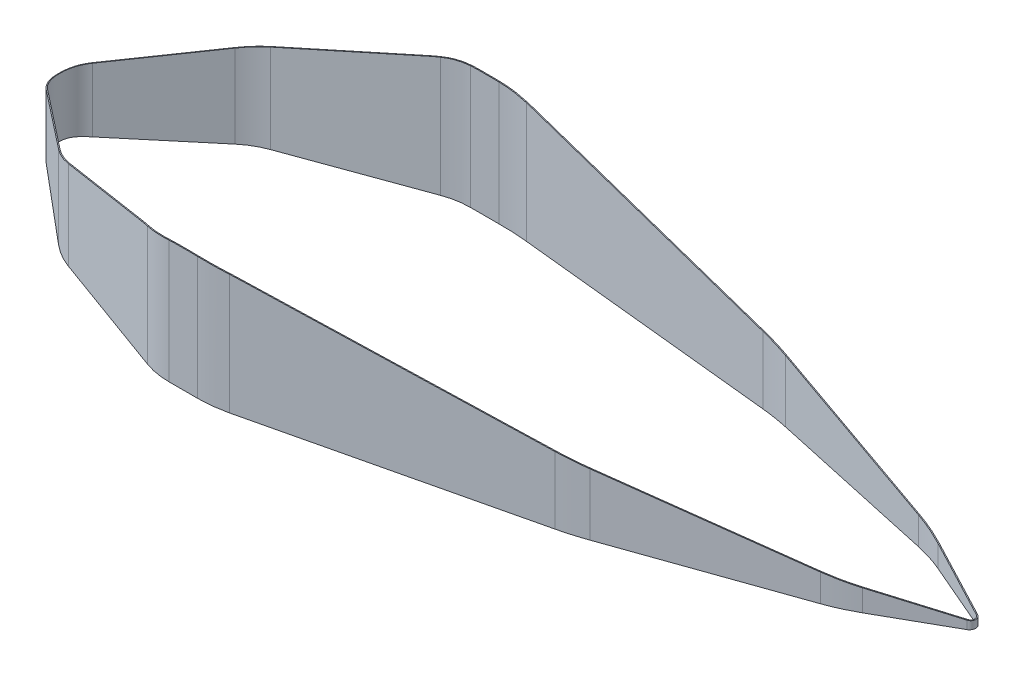
from build123d import *

# Parameters (mm, degrees)
TOPVIEW_EXTRUDE_DEPTH      = 800
SHELL1_T                   = -5
SIDEPROFILE_CUT_DEPTH      = 5065.329373382
SIDEPROFILE_CUT_DEPTH_BACK = 5065.329373382
SKETCH2_OUTSIDE_W          = 5882.814
SKETCH2_OUTSIDE_H          = 1835.392


with BuildPart() as part:
    # Sketch1 → TopView_Extrude (new body)
    with BuildSketch(Plane(origin=(0, 0, 0), x_dir=(1, 0, 0), z_dir=(0, 1, 0))):
        with BuildLine():
            Line((146.069849076, 122.567124227), (556.148324977, 466.663731547))
            ThreePointArc((556.148324977, 466.663731547), (613.263316637, 506.656075273), (676.455195963, 536.122941687))
            Line((676.455195963, 536.122941687), (1335.173700718, 775.877020708))
            ThreePointArc((1335.173700718, 775.877020708), (1402.522523085, 793.923094197), (1471.981833896, 800))
            Line((1471.981833896, 800), (1622.74932188, 800))
            ThreePointArc((1622.74932188, 800), (1701.208389168, 796.917335971), (1779.183730567, 787.688349521))
            Line((1779.183730567, 787.688349521), (3265.383087903, 552.297583021))
            ThreePointArc((3265.383087903, 552.297583021), (3342.599008928, 537.986460302), (3418.960120906, 519.653777172))
            Line((3418.960120906, 519.653777172), (4378.134590748, 262.643696963))
            ThreePointArc((4378.134590748, 262.643696963), (4461.335543574, 236.410539363), (4541.933526436, 203.025778355))
            Line((4541.933526436, 203.025778355), (4919.016455083, 27.18923681))
            ThreePointArc((4919.016455083, 27.18923681), (4936.337914092, 0), (4919.016455083, -27.18923681))
            Line((4919.016455083, -27.18923681), (4541.933526436, -203.025778355))
            ThreePointArc((4541.933526436, -203.025778355), (4461.335543574, -236.410539363), (4378.134590748, -262.643696963))
            Line((4378.134590748, -262.643696963), (3418.960120906, -519.653777172))
            ThreePointArc((3418.960120906, -519.653777172), (3342.599008928, -537.986460302), (3265.383087903, -552.297583021))
            Line((3265.383087903, -552.297583021), (1779.183730567, -787.688349521))
            ThreePointArc((1779.183730567, -787.688349521), (1701.208389168, -796.917335971), (1622.74932188, -800))
            Line((1622.74932188, -800), (1471.981833896, -800))
            ThreePointArc((1471.981833896, -800), (1402.522523085, -793.923094197), (1335.173700718, -775.877020708))
            Line((1335.173700718, -775.877020708), (676.455195963, -536.122941687))
            ThreePointArc((676.455195963, -536.122941687), (613.263316637, -506.656075273), (556.148324977, -466.663731547))
            Line((556.148324977, -466.663731547), (146.069849076, -122.567124227))
            ThreePointArc((146.069849076, -122.567124227), (88.915850742, 0), (146.069849076, 122.567124227))
        make_face()
    extrude(amount=TOPVIEW_EXTRUDE_DEPTH)

    # Shell1
    shell1_openings = [part.faces().sort_by_distance(p)[0] for p in [
        (2250.068887565, 800, 0),
        (2250.068887565, 0, 0),
    ]]
    offset(amount=SHELL1_T, openings=shell1_openings, kind=Kind.INTERSECTION)

    # Sketch2 outside → SideProfile_Cut (cut, two sides: drawn at the far end of the back side and taken through both)
    with BuildSketch(Plane.XY.offset(-SIDEPROFILE_CUT_DEPTH_BACK)):
        with Locations((2512.627, 400)):
            Rectangle(SKETCH2_OUTSIDE_W, SKETCH2_OUTSIDE_H)
        with BuildLine():
            Line((0, 300), (0, 332.854125267))
            ThreePointArc((0, 332.854125267), (31.780430043, 425.180358155), (113.65511039, 478.384359237))
            Line((113.65511039, 478.384359237), (1282.133703367, 770.201559797))
            ThreePointArc((1282.133703367, 770.201559797), (1402.370605908, 792.522432945), (1524.432967436, 800))
            Line((1524.432967436, 800), (1576.231046196, 800))
            ThreePointArc((1576.231046196, 800), (1701.206287536, 796.091478127), (1825.693060411, 784.381189052))
            Line((1825.693060411, 784.381189052), (4977.324, 388.181))
            Line((4977.324, 388.181), (4977.324, 355.91))
            Line((4977.324, 355.91), (1795.457321969, 155.908910924))
            ThreePointArc((1795.457321969, 155.908910924), (1701.40460764, 151.477591611), (1607.259154289, 150))
            Line((1607.259154289, 150), (150, 150))
            ThreePointArc((150, 150), (43.933982822, 193.933982822), (0, 300))
        make_face(mode=Mode.SUBTRACT)
    extrude(amount=SIDEPROFILE_CUT_DEPTH + SIDEPROFILE_CUT_DEPTH_BACK, mode=Mode.SUBTRACT)


solid = part.part
